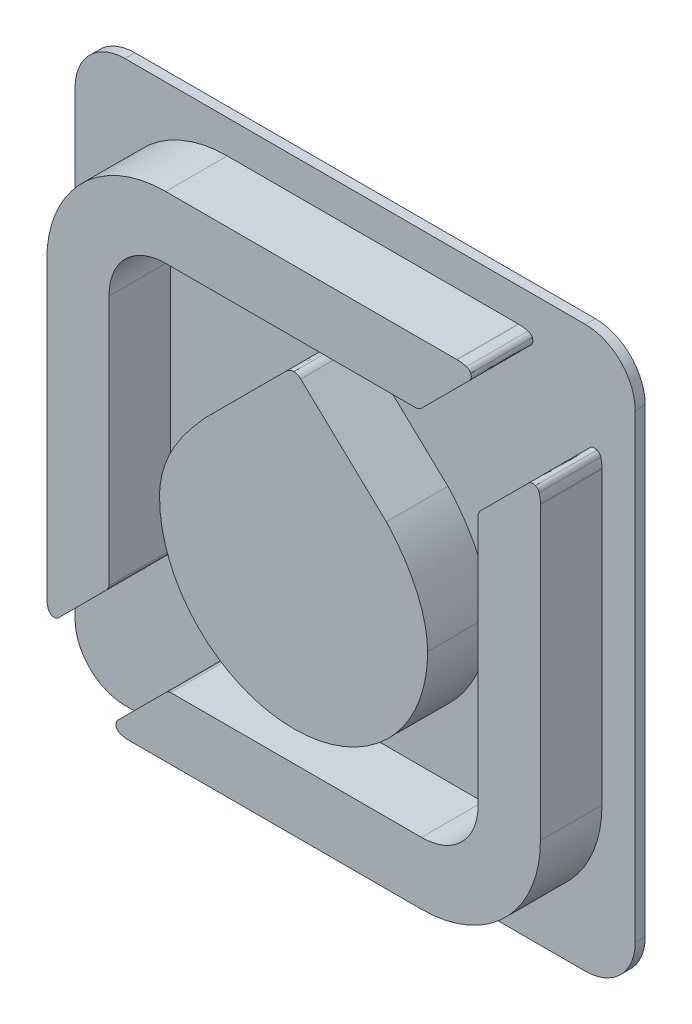
from build123d import *

# Parameters (mm, degrees)
BOSS_EXTRUDE1_DEPTH   = 3.7
BOSS_EXTRUDE1_2_DEPTH = 3.7
BOSS_EXTRUDE1_3_DEPTH = 3.7
SKETCH2_W             = 33.674533553
SKETCH2_H             = 33.674874065
BOSS_EXTRUDE2_DEPTH   = 0.6
FILLET1_R             = 3


with BuildPart() as part:
    # Sketch1 → Boss-Extrude1 (new body)
    with BuildSketch(Plane.XY):
        with BuildLine():
            Line((-0.443865, 10.373853), (-5.297311, 5.52069))
            add(Edge.make_bspline(
                [(-5.297311, 5.52069), (-5.311105, 5.508025), (-5.323488, 5.495607), (-5.334388, 5.483225)],
                knots=[0, 0, 0, 0, 1, 1, 1, 1], degree=3))
            add(Edge.make_bspline(
                [(-5.334388, 5.483225), (-6.621322, 4.056944), (-8.07653, 2.259965), (-8.07653, 0)],
                knots=[0, 0, 0, 0, 1, 1, 1, 1], degree=3))
            add(Edge.make_bspline(
                [(-8.07653, 0), (-8.07653, -4.440026), (-4.43865, -8.039347), (0, -8.039347)],
                knots=[0, 0, 0, 0, 1, 1, 1, 1], degree=3))
            add(Edge.make_bspline(
                [(0, -8.039347), (4.441401, -8.039347), (8.039488, -4.440026), (8.039488, 0)],
                knots=[0, 0, 0, 0, 1, 1, 1, 1], degree=3))
            add(Edge.make_bspline(
                [(8.039488, 0), (8.039488, 2.101497), (6.815631, 4.190753), (5.557626, 5.52069)],
                knots=[0, 0, 0, 0, 1, 1, 1, 1], degree=3))
            Line((5.557626, 5.52069), (0.407776, 10.373853))
            add(Edge.make_bspline(
                [(0.407776, 10.373853), (0.294887, 10.482862), (0.154481, 10.558674), (0, 10.558674)],
                knots=[0, 0, 0, 0, 1, 1, 1, 1], degree=3))
            add(Edge.make_bspline(
                [(0, 10.558674), (-0.150354, 10.558674), (-0.329495, 10.486989), (-0.443865, 10.373853)],
                knots=[0, 0, 0, 0, 1, 1, 1, 1], degree=3))
        make_face()
    extrude(amount=BOSS_EXTRUDE1_DEPTH)



with BuildPart() as body_2:
    # Sketch1 → Boss-Extrude1 2 (new body)
    with BuildSketch(Plane.XY):
        with BuildLine():
            Line((-7.706114447, 12.34059), (7.372630553, 12.34059))
            add(Edge.make_bspline(
                [(7.372630553, 12.34059), (7.440010553, 12.347222), (7.504922553, 12.373398), (7.558544553, 12.41365)],
                knots=[0, 0, 0, 0, 1, 1, 1, 1], degree=3))
            add(Edge.make_bspline(
                [(7.558544553, 12.41365), (7.584720553, 12.424515), (7.609379553, 12.435416), (7.633086553, 12.450586)],
                knots=[0, 0, 0, 0, 1, 1, 1, 1], degree=3))
            Line((7.633086553, 12.450586), (10.560048553, 15.377653))
            add(Edge.make_bspline(
                [(10.560048553, 15.377653), (10.660484553, 15.483769), (10.690964553, 15.650386), (10.633073553, 15.785429)],
                knots=[0, 0, 0, 0, 1, 1, 1, 1], degree=3))
            add(Edge.make_bspline(
                [(10.633073553, 15.785429), (10.588975553, 15.894438), (10.489492553, 15.97988), (10.373746553, 16.007291)],
                knots=[0, 0, 0, 0, 1, 1, 1, 1], degree=3))
            add(Edge.make_bspline(
                [(10.373746553, 16.007291), (10.197357553, 16.052905), (10.008691553, 16.091358), (9.818509553, 16.081833)],
                knots=[0, 0, 0, 0, 1, 1, 1, 1], degree=3))
            add(Edge.make_bspline(
                [(9.818509553, 16.081833), (9.806126553, 16.081833), (9.793850553, 16.083209), (9.781432553, 16.081833)],
                knots=[0, 0, 0, 0, 1, 1, 1, 1], degree=3))
            Line((9.781432553, 16.081833), (-7.706111553, 16.081833))
            add(Edge.make_bspline(
                [(-7.706111553, 16.081833), (-11.630782553, 16.081833), (-14.855115553, 12.858467), (-14.855115553, 8.932298)],
                knots=[0, 0, 0, 0, 1, 1, 1, 1], degree=3))
            Line((-14.855115553, 8.932298), (-14.853739447, -8.554862))
            add(Edge.make_bspline(
                [(-14.853739447, -8.554862), (-14.855118447, -8.567138), (-14.853739447, -8.578145), (-14.853739447, -8.590422)],
                knots=[0, 0, 0, 0, 1, 1, 1, 1], degree=3))
            add(Edge.make_bspline(
                [(-14.853739447, -8.590422), (-14.863661447, -8.78198), (-14.824801447, -8.969658), (-14.780703447, -9.147563)],
                knots=[0, 0, 0, 0, 1, 1, 1, 1], degree=3))
            add(Edge.make_bspline(
                [(-14.780703447, -9.147563), (-14.751765447, -9.261793), (-14.667842447, -9.360888), (-14.557736447, -9.406361)],
                knots=[0, 0, 0, 0, 1, 1, 1, 1], degree=3))
            add(Edge.make_bspline(
                [(-14.557736447, -9.406361), (-14.424069447, -9.464217), (-14.255808447, -9.433913), (-14.149562447, -9.331925)],
                knots=[0, 0, 0, 0, 1, 1, 1, 1], degree=3))
            Line((-14.149562447, -9.331925), (-11.223979447, -6.404998))
            add(Edge.make_bspline(
                [(-11.223979447, -6.404998), (-11.208845447, -6.381715), (-11.196568447, -6.356633), (-11.186902447, -6.330562)],
                knots=[0, 0, 0, 0, 1, 1, 1, 1], degree=3))
            add(Edge.make_bspline(
                [(-11.186902447, -6.330562), (-11.145698447, -6.278351), (-11.119239447, -6.21344), (-11.112501447, -6.14606)],
                knots=[0, 0, 0, 0, 1, 1, 1, 1], degree=3))
            Line((-11.112501447, -6.14606), (-11.113877447, 8.932298))
            add(Edge.make_bspline(
                [(-11.113877447, 8.932298), (-11.113877447, 10.856453), (-9.632634447, 12.34059), (-7.706114447, 12.34059)],
                knots=[0, 0, 0, 0, 1, 1, 1, 1], degree=3))
        make_face()
    extrude(amount=BOSS_EXTRUDE1_2_DEPTH)


with BuildPart() as body_3:
    # Sketch1 → Boss-Extrude1 3 (new body)
    with BuildSketch(Plane.XY):
        with BuildLine():
            Line((7.670024, -9.854495), (-7.408334, -9.854495))
            add(Edge.make_bspline(
                [(-7.408334, -9.854495), (-7.475714, -9.862609), (-7.540625, -9.888679), (-7.594248, -9.928508)],
                knots=[0, 0, 0, 0, 1, 1, 1, 1], degree=3))
            add(Edge.make_bspline(
                [(-7.594248, -9.928508), (-7.620424, -9.938421), (-7.645506, -9.950803), (-7.668789, -9.965973)],
                knots=[0, 0, 0, 0, 1, 1, 1, 1], degree=3))
            Line((-7.668789, -9.965973), (-10.595751, -12.892928))
            add(Edge.make_bspline(
                [(-10.595751, -12.892928), (-10.696187, -12.999177), (-10.726667, -13.165642), (-10.668776, -13.300689)],
                knots=[0, 0, 0, 0, 1, 1, 1, 1], degree=3))
            add(Edge.make_bspline(
                [(-10.668776, -13.300689), (-10.624679, -13.409694), (-10.524067, -13.495133), (-10.409838, -13.522692)],
                knots=[0, 0, 0, 0, 1, 1, 1, 1], degree=3))
            add(Edge.make_bspline(
                [(-10.409838, -13.522692), (-10.233449, -13.568169), (-10.044677, -13.606615), (-9.854495, -13.597107)],
                knots=[0, 0, 0, 0, 1, 1, 1, 1], degree=3))
            add(Edge.make_bspline(
                [(-9.854495, -13.597107), (-9.84183, -13.59559), (-9.829553, -13.597107), (-9.817136, -13.597107)],
                knots=[0, 0, 0, 0, 1, 1, 1, 1], degree=3))
            Line((-9.817136, -13.597107), (7.670024, -13.597107))
            add(Edge.make_bspline(
                [(7.670024, -13.597107), (11.594676, -13.597107), (14.820935, -10.372373), (14.819418, -6.446344)],
                knots=[0, 0, 0, 0, 1, 1, 1, 1], degree=3))
            Line((14.819418, -6.446344), (14.818042, 11.039475))
            add(Edge.make_bspline(
                [(14.818042, 11.039475), (14.819418, 11.051857), (14.818042, 11.064275), (14.818042, 11.07694)],
                knots=[0, 0, 0, 0, 1, 1, 1, 1], degree=3))
            add(Edge.make_bspline(
                [(14.818042, 11.07694), (14.827567, 11.267122), (14.789114, 11.455752), (14.743641, 11.632141)],
                knots=[0, 0, 0, 0, 1, 1, 1, 1], degree=3))
            add(Edge.make_bspline(
                [(14.743641, 11.632141), (14.716054, 11.746547), (14.630752, 11.846983), (14.521779, 11.89108)],
                knots=[0, 0, 0, 0, 1, 1, 1, 1], degree=3))
            add(Edge.make_bspline(
                [(14.521779, 11.89108), (14.386595, 11.948971), (14.220119, 11.918632), (14.113862, 11.816679)],
                knots=[0, 0, 0, 0, 1, 1, 1, 1], degree=3))
            Line((14.113862, 11.816679), (11.186901, 8.889717))
            add(Edge.make_bspline(
                [(11.186901, 8.889717), (11.171766, 8.86781), (11.159349, 8.841775), (11.149859, 8.816692)],
                knots=[0, 0, 0, 0, 1, 1, 1, 1], degree=3))
            add(Edge.make_bspline(
                [(11.149859, 8.816692), (11.109607, 8.76307), (11.083572, 8.698159), (11.076799, 8.630778)],
                knots=[0, 0, 0, 0, 1, 1, 1, 1], degree=3))
            Line((11.076799, 8.630778), (11.077892, -6.446344))
            add(Edge.make_bspline(
                [(11.077892, -6.446344), (11.079303, -8.371311), (9.596508, -9.854495), (7.670024, -9.854495)],
                knots=[0, 0, 0, 0, 1, 1, 1, 1], degree=3))
        make_face()
    extrude(amount=BOSS_EXTRUDE1_3_DEPTH)


with BuildPart() as part_1:
    add(part.part)

    add(body_2.part)  # Boss-Extrude2 merges body 2

    add(body_3.part)  # Boss-Extrude2 merges body 3
    # Sketch2 → Boss-Extrude2 (add)
    with BuildSketch(Plane.XY):
        with Locations((-0.017848776, 1.240330032)):
            Rectangle(SKETCH2_W, SKETCH2_H)
    extrude(amount=-BOSS_EXTRUDE2_DEPTH)

    # Fillet1
    fillet1_edges = [part_1.edges().sort_by_distance(p)[0] for p in [
        (-16.855115553, -15.597107, -0.3),
        (-16.855115553, 18.077767065, -0.3),
        (16.819418, 18.077767065, -0.3),
        (16.819418, -15.597107, -0.3),
    ]]
    fillet(fillet1_edges, radius=FILLET1_R)


solid = part_1.part
